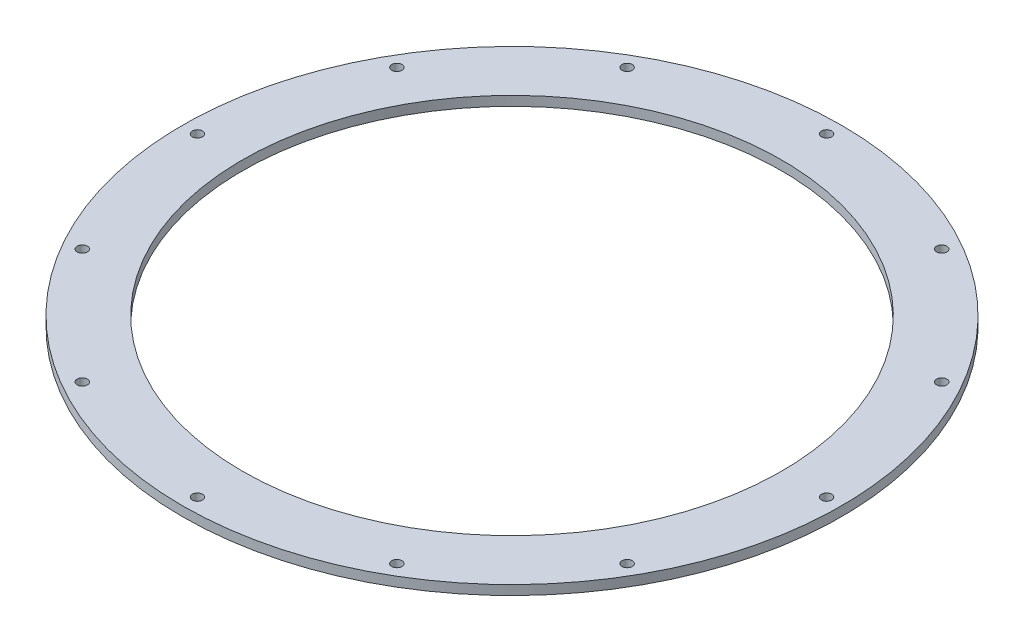
from build123d import *

# Parameters (mm, degrees)
SKETCH1_R            = 110
SKETCH1_R_2          = 90
BOSS_EXTRUDE1_DEPTH  = 3.175
M3_CLEARANCE_HOLE1_D = 3.4


with BuildPart() as part:
    # Sketch1 → Boss-Extrude1 (new body)
    with BuildSketch(Plane(origin=(0, 0, 0), x_dir=(1, 0, 0), z_dir=(0, 1, 0))):
        with Locations(Location((0, 0, 0), (0, 0, 270))):
            Circle(SKETCH1_R)
        with Locations(Location((0, 0, 0), (0, 0, 270))):
            Circle(SKETCH1_R_2, mode=Mode.SUBTRACT)
    extrude(amount=BOSS_EXTRUDE1_DEPTH)

    # M3 Clearance Hole1 (through all)
    with Locations(Plane(origin=(0, 3.175, 0), x_dir=(1, 0, 0), z_dir=(0, 1, 0))):
        with Locations((0, 105), (52.5, 90.932667397), (90.932667397, 52.5), (105, 0), (90.932667397, -52.5), (52.5, -90.932667397), (0, -105), (-52.5, -90.932667397), (-90.932667397, -52.5), (-105, 0), (-90.932667397, 52.5), (-52.5, 90.932667397)):
            Hole(M3_CLEARANCE_HOLE1_D / 2)


solid = part.part
